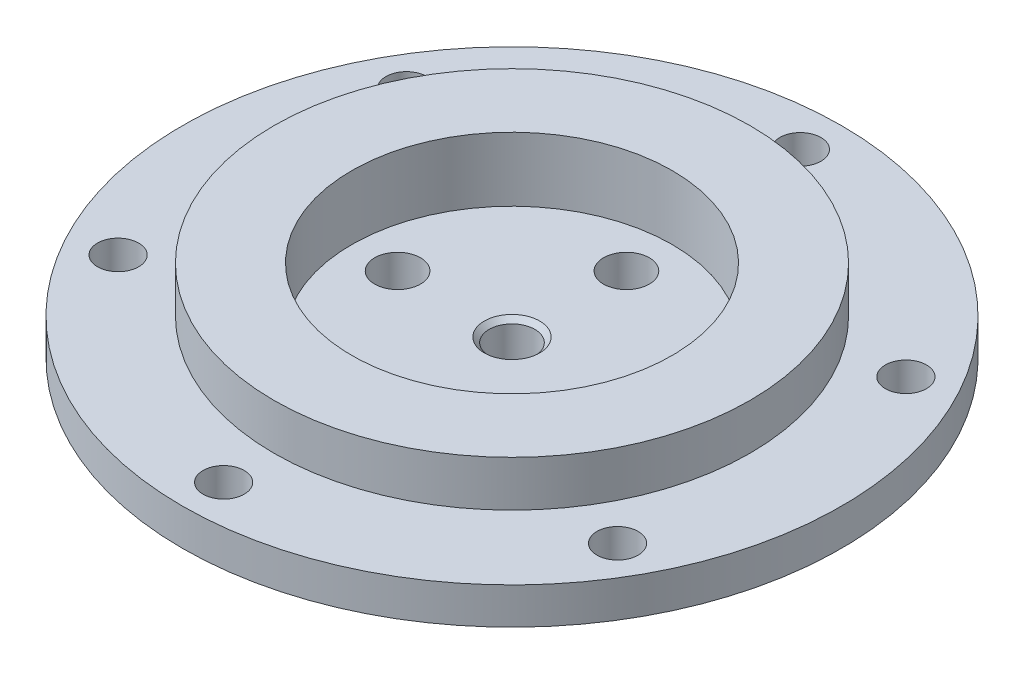
from build123d import *

# Parameters (mm, degrees)
SKETCH2_R                   = 2.25
CUT_EXTRUDE1_DEPTH          = 52.536394907
SKETCH4_R                   = 2.5
CUT_EXTRUDE3_DEPTH          = 10
M6_TAPPED_HOLE1_D           = 5
M6_TAPPED_HOLE1_DEPTH       = 15
M6_TAPPED_HOLE1_CSINK_D     = 6.05
M6_TAPPED_HOLE1_CSINK_ANGLE = 90
M6_TAPPED_HOLE1_TIP         = 1.502151548
SKETCH9_R                   = 2.5
CUT_EXTRUDE4_DEPTH          = 52.39066063
M6_TAPPED_HOLE2_D           = 5
M6_TAPPED_HOLE2_DEPTH       = 65
M6_TAPPED_HOLE2_CSINK_D     = 6.05
M6_TAPPED_HOLE2_CSINK_ANGLE = 90
M6_TAPPED_HOLE2_TIP         = 1.502151548


with BuildPart() as part:
    # Sketch1 → Revolve1 (revolve)
    with BuildSketch(Plane.XY, mode=Mode.PRIVATE) as revolve1_sk:
        Polygon((27.5, 0), (27.5, -4), (0, -4), (0, 2), (17.5, 2), (17.5, 9), (26, 9), (26, 4), (36, 4), (36, 0), align=None)
    revolve(revolve1_sk.sketch.rotate(Axis((0, 0, 0), (0, 1, 0)), 90), axis=Axis((0, 0, 0), (0, 1, 0)))

    # Sketch2 → Cut-Extrude1 (cut, through all)
    with BuildSketch(Plane(origin=(0, 4, 0), x_dir=(1, 0, 0), z_dir=(0, 1, 0))):
        with Locations(Location((0, 31.5, 0), (0, 0, 270))):
            Circle(SKETCH2_R)
        with Locations(Location((27.279800219, 15.75, 0), (0, 0, 270))):
            Circle(SKETCH2_R)
        with Locations(Location((27.279800219, -15.75, 0), (0, 0, 270))):
            Circle(SKETCH2_R)
        with Locations(Location((0, -31.5, 0), (0, 0, 270))):
            Circle(SKETCH2_R)
        with Locations(Location((-27.279800219, -15.75, 0), (0, 0, 270))):
            Circle(SKETCH2_R)
        with Locations(Location((-27.279800219, 15.75, 0), (0, 0, 270))):
            Circle(SKETCH2_R)
    extrude(amount=-CUT_EXTRUDE1_DEPTH, mode=Mode.SUBTRACT)

    # Sketch4 → Cut-Extrude3 (cut)
    with BuildSketch(Plane(origin=(0, 2, 0), x_dir=(1, 0, 0), z_dir=(0, 1, 0))):
        with Locations(Location((12.5, 0, 0), (0, 0, 270))):
            Circle(SKETCH4_R)
        with Locations(Location((0, -12.5, 0), (0, 0, 270))):
            Circle(SKETCH4_R)
        with Locations(Location((-12.5, 0, 0), (0, 0, 270))):
            Circle(SKETCH4_R)
        with Locations(Location((0, 12.5, 0), (0, 0, 270))):
            Circle(SKETCH4_R)
    extrude(amount=-CUT_EXTRUDE3_DEPTH, mode=Mode.SUBTRACT)

    # M6 Tapped Hole1
    with Locations(Plane(origin=(-12.5, 9, 0), x_dir=(0, 0, 1), z_dir=(0, 1, 0))):
        with Locations((0, 0), (0, 25), (-12.5, 12.5), (12.5, 12.5)):
            CounterSinkHole(M6_TAPPED_HOLE1_D / 2, M6_TAPPED_HOLE1_CSINK_D / 2, depth=M6_TAPPED_HOLE1_DEPTH, counter_sink_angle=M6_TAPPED_HOLE1_CSINK_ANGLE)
            with Locations((0, 0, -(M6_TAPPED_HOLE1_DEPTH + M6_TAPPED_HOLE1_TIP / 2))):  # 118° drill point
                Cone(0, M6_TAPPED_HOLE1_D / 2, M6_TAPPED_HOLE1_TIP, mode=Mode.SUBTRACT)

    # Sketch9 → Cut-Extrude4 (cut, through all)
    with BuildSketch(Plane(origin=(0, 2, 0), x_dir=(1, 0, 0), z_dir=(0, 1, 0))):
        with Locations(Location((0, 0, 0), (0, 0, 270))):
            Circle(SKETCH9_R)
    extrude(amount=-CUT_EXTRUDE4_DEPTH, mode=Mode.SUBTRACT)

    # M6 Tapped Hole2
    with Locations(Plane.ZX.offset(2)):
        with Locations((0, 0)):
            CounterSinkHole(M6_TAPPED_HOLE2_D / 2, M6_TAPPED_HOLE2_CSINK_D / 2, depth=M6_TAPPED_HOLE2_DEPTH, counter_sink_angle=M6_TAPPED_HOLE2_CSINK_ANGLE)
            with Locations((0, 0, -(M6_TAPPED_HOLE2_DEPTH + M6_TAPPED_HOLE2_TIP / 2))):  # 118° drill point
                Cone(0, M6_TAPPED_HOLE2_D / 2, M6_TAPPED_HOLE2_TIP, mode=Mode.SUBTRACT)


solid = part.part
